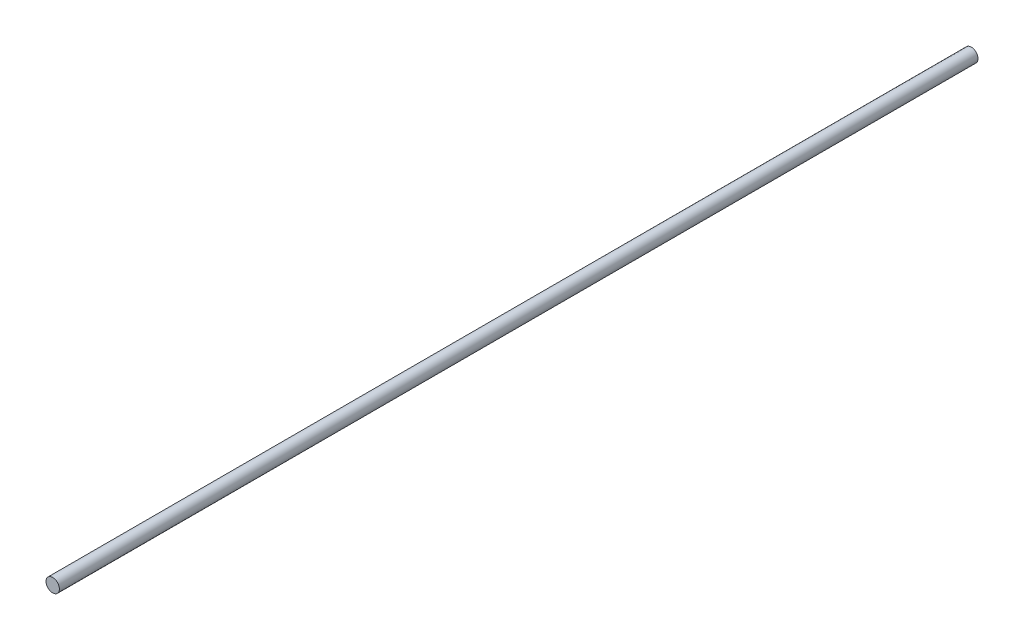
from build123d import *

# Parameters (mm, degrees)
SKETCH_1_R      = 12.5
EXTRUDE_1_DEPTH = 1712


with BuildPart() as part:
    # Эскиз1 → Бобышка-Вытянуть1 (new body)
    with BuildSketch(Plane.XY):
        Circle(SKETCH_1_R)
    extrude(amount=EXTRUDE_1_DEPTH)


solid = part.part
